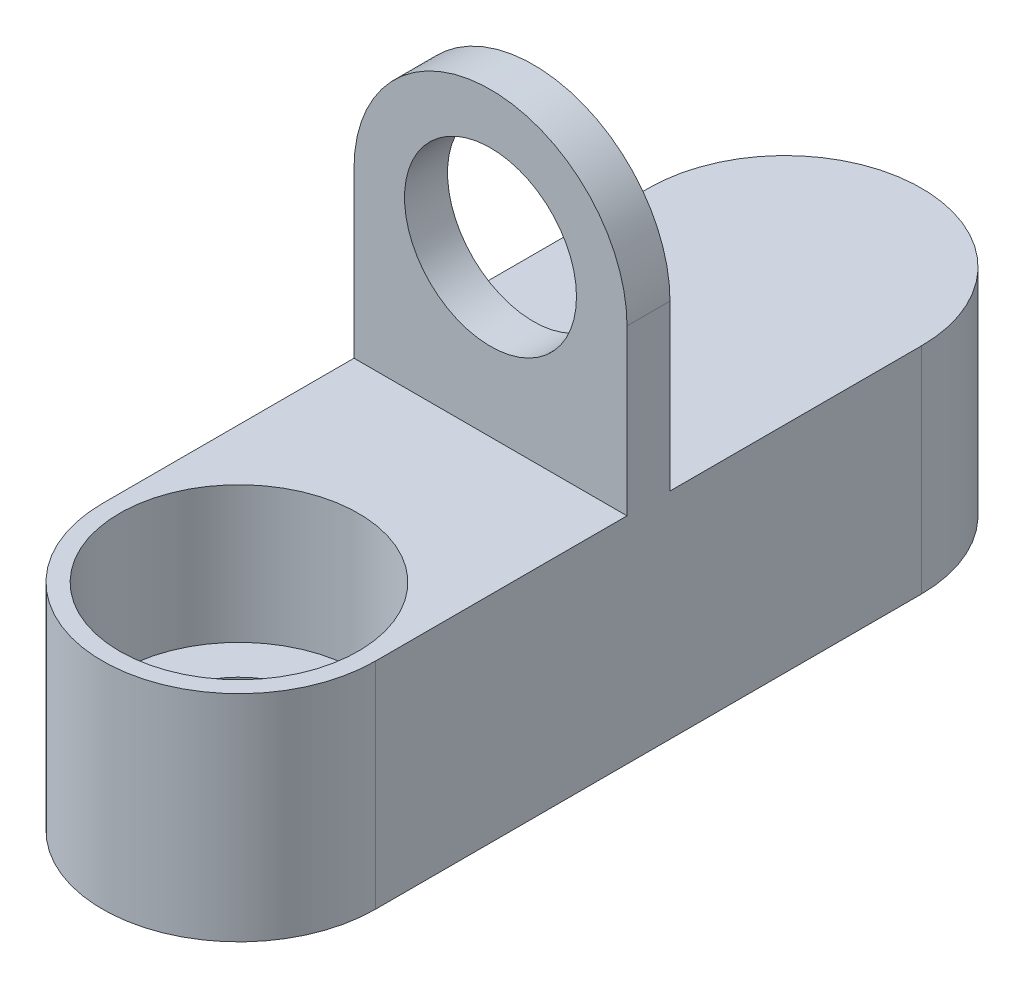
from build123d import *

# Parameters (mm, degrees)
BOSS_EXTRUDE1_DEPTH                              = 10
CBORE_FOR_1_4_SOCKET_HEAD_CAP_SCREW1_D           = 7.14248
CBORE_FOR_1_4_SOCKET_HEAD_CAP_SCREW1_CBORE_D     = 11.1125
CBORE_FOR_1_4_SOCKET_HEAD_CAP_SCREW1_CBORE_DEPTH = 6.35
SKETCH5_W                                        = 12.7
SKETCH5_H                                        = 2
BOSS_EXTRUDE2_DEPTH                              = 14
CUT_EXTRUDE1_DEPTH                               = 10
SKETCH7_R                                        = 4
CUT_EXTRUDE2_DEPTH                               = 10


with BuildPart() as part:
    # Sketch1 → Boss-Extrude1 (new body)
    with BuildSketch(Plane(origin=(0, 0, 0), x_dir=(1, 0, 0), z_dir=(0, 1, 0))):
        with BuildLine():
            Line((6.35, 12.7), (6.35, -12.7))
            ThreePointArc((6.35, -12.7), (0, -19.05), (-6.35, -12.7))
            Line((-6.35, -12.7), (-6.35, 12.7))
            ThreePointArc((-6.35, 12.7), (0, 19.05), (6.35, 12.7))
        make_face()
    extrude(amount=BOSS_EXTRUDE1_DEPTH)

    # CBORE for 1/4 Socket Head Cap Screw1 (through all)
    with Locations(Plane(origin=(0, 10, 0), x_dir=(1, 0, 0), z_dir=(0, 1, 0))):
        with Locations((0, -12.7)):
            CounterBoreHole(CBORE_FOR_1_4_SOCKET_HEAD_CAP_SCREW1_D / 2, CBORE_FOR_1_4_SOCKET_HEAD_CAP_SCREW1_CBORE_D / 2, CBORE_FOR_1_4_SOCKET_HEAD_CAP_SCREW1_CBORE_DEPTH)

    # Sketch5 → Boss-Extrude2 (add)
    with BuildSketch(Plane(origin=(0, 10, 0), x_dir=(1, 0, 0), z_dir=(0, 1, 0))):
        Rectangle(SKETCH5_W, SKETCH5_H)
    extrude(amount=BOSS_EXTRUDE2_DEPTH)

    # Sketch6 → Cut-Extrude1 (cut)
    with BuildSketch(Plane.XY.offset(1)):
        with BuildLine():
            Line((-6.35, 24), (-6.35, 17.65))
            ThreePointArc((-6.35, 17.65), (-4.490128051, 22.14012807), (2.8e-08, 24))
            Line((2.8e-08, 24), (-6.35, 24))
        make_face()
        with BuildLine():
            Line((6.35, 24), (2.8e-08, 24))
            ThreePointArc((2.8e-08, 24), (4.49012807, 22.140128051), (6.35, 17.65))
            Line((6.35, 17.65), (6.35, 24))
        make_face()
    extrude(amount=-CUT_EXTRUDE1_DEPTH, mode=Mode.SUBTRACT)

    # Sketch7 → Cut-Extrude2 (cut)
    with BuildSketch(Plane.XY.offset(1)):
        with Locations((0, 17.65)):
            Circle(SKETCH7_R)
    extrude(amount=-CUT_EXTRUDE2_DEPTH, mode=Mode.SUBTRACT)


solid = part.part
